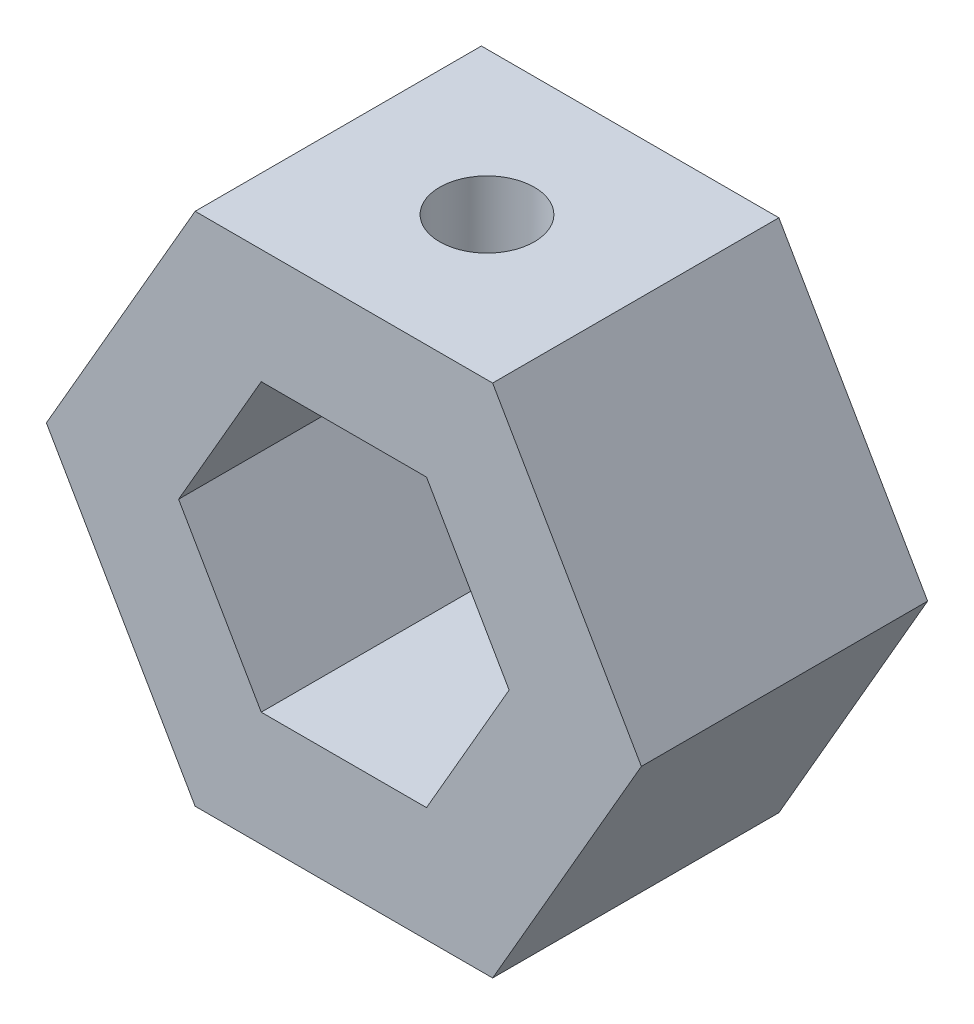
from build123d import *

# Parameters (mm, degrees)
BOSS_EXTRUDE1_DEPTH                            = 2.54
CSK_FOR_M3_FLAT_HEAD_MACHINE_SCREW1_AT_2_COUNT = 2
CSK_FOR_M3_FLAT_HEAD_MACHINE_SCREW1_AT_2_PITCH = 18.548356757
BOSS_EXTRUDE2_DEPTH                            = 12.7
M5X0_8_TAPPED_HOLE1_D                          = 4.2
M5X0_8_TAPPED_HOLE1_DEPTH                      = 5.08


with BuildPart() as part:
    # Sketch1 → Boss-Extrude1 (new body)
    # profile 1 of 2: a face of its own
    with BuildSketch(Plane.XY):
        Polygon((6.599113577, -11.43), (13.198227154, 0), (6.599113577, 11.43), (-6.599113577, 11.43), (-13.198227154, 0), (-6.599113577, -11.43), align=None)
        Polygon((-3.666174209, -6.35), (3.666174209, -6.35), (7.332348419, 0), (3.666174209, 6.35), (-3.666174209, 6.35), (-7.332348419, 0), align=None, mode=Mode.SUBTRACT)
    # profile 2 of 2: a face of its own
    with BuildSketch(Plane.XY):
        Polygon((-7.332348419, 0), (-3.666174209, -6.35), (3.666174209, -6.35), (7.332348419, 0), (3.666174209, 6.35), (-3.666174209, 6.35), align=None)
    extrude(amount=BOSS_EXTRUDE1_DEPTH)

    # Sketch3 → CSK for M3 Flat Head Machine Screw1 (revolve, cut)
    with BuildSketch(Plane(origin=(0, 0, 2.54), x_dir=(0, -1, 0), z_dir=(1, 0, 0))):
        Polygon((0, 0), (0, 2.54), (1.7, 2.54), (1.7, 1.45), (3.15, 0), align=None)
    csk_for_m3_flat_head_machine_screw1 = revolve(axis=Axis((0, 0, 8.89), (0, 0, -1)), mode=Mode.SUBTRACT)

    # CSK for M3 Flat Head Machine Screw1 at 2: CSK for M3 Flat Head Machine Screw1 ×2
    with Locations(*[Vector(-0.9274068813992224, 0.37405410883101997, 0) * (i * CSK_FOR_M3_FLAT_HEAD_MACHINE_SCREW1_AT_2_PITCH) for i in range(1, CSK_FOR_M3_FLAT_HEAD_MACHINE_SCREW1_AT_2_COUNT)]):
        add(csk_for_m3_flat_head_machine_screw1, mode=Mode.SUBTRACT)

    # Sketch1<4> → Boss-Extrude2 (add)
    with BuildSketch(Plane.XY):
        Polygon((6.599113577, 11.43), (-6.599113577, 11.43), (-13.198227154, 0), (-6.599113577, -11.43), (6.599113577, -11.43), (13.198227154, 0), align=None)
        Polygon((3.666174209, -6.35), (7.332348419, 0), (3.666174209, 6.35), (-3.666174209, 6.35), (-7.332348419, 0), (-3.666174209, -6.35), align=None, mode=Mode.SUBTRACT)
    extrude(amount=BOSS_EXTRUDE2_DEPTH)

    # M5x0.8 Tapped Hole1
    with Locations(Plane(origin=(0, 11.43, 0), x_dir=(1, 0, 0), z_dir=(0, 1, 0))):
        with Locations((0, -6.35)):
            Hole(M5X0_8_TAPPED_HOLE1_D / 2, depth=M5X0_8_TAPPED_HOLE1_DEPTH)


solid = part.part
